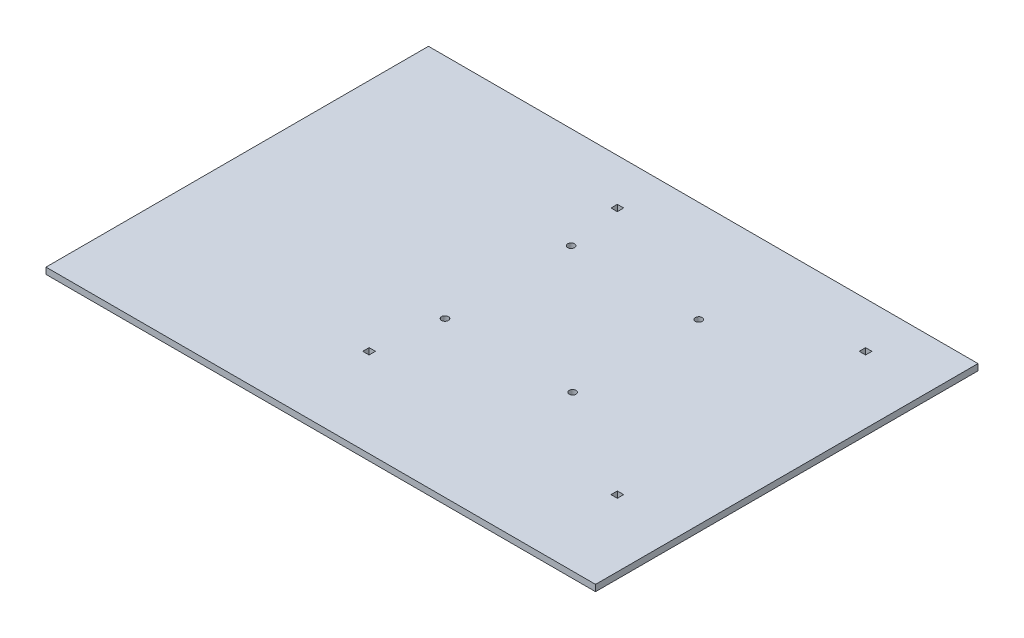
from build123d import *

# Parameters (mm, degrees)
SKETCH1_W           = 140
SKETCH1_H           = 160
BOSS_EXTRUDE1_DEPTH = 3
SKETCH2_W           = 120
SKETCH2_H           = 120
SKETCH2_W_2         = 114
SKETCH2_H_2         = 114
BOSS_EXTRUDE2_DEPTH = 70
SKETCH4_W           = 120
SKETCH4_H           = 120
BOSS_EXTRUDE4_DEPTH = 3
SKETCH5_R           = 2.1
SKETCH5_W           = 39.9
SKETCH5_H           = 19.71
CUT_EXTRUDE2_DEPTH  = 3
SKETCH6_W           = 18.298163042
SKETCH6_H           = 17.309993256
CUT_EXTRUDE3_DEPTH  = 3
CUT_EXTRUDE8_DEPTH  = 5
SKETCH15_W          = 259.021634325
SKETCH15_H          = 180.269434884
BOSS_EXTRUDE5_DEPTH = 3
SKETCH18_R          = 1.6
CUT_EXTRUDE9_DEPTH  = 10
SKETCH19_W          = 12
SKETCH19_H          = 4.5
SKETCH19_H_2        = 8.4
SKETCH19_W_2        = 10.084057066
SKETCH19_H_3        = 7.362028533
CUT_EXTRUDE11_DEPTH = 5
SKETCH20_W          = 147.415821731
SKETCH20_H          = 93.246752781
CUT_EXTRUDE13_DEPTH = 262.306082135
SKETCH21_W          = 3
SKETCH21_H          = 3
CUT_EXTRUDE14_DEPTH = 197.5483972


with BuildPart() as part:
    # Sketch1 → Boss-Extrude1 (new body)
    with BuildSketch(Plane(origin=(0, 0, 0), x_dir=(1, 0, 0), z_dir=(0, 1, 0))):
        Rectangle(SKETCH1_W, SKETCH1_H)
    extrude(amount=BOSS_EXTRUDE1_DEPTH)

    # Sketch2 → Boss-Extrude2 (add)
    with BuildSketch(Plane(origin=(0, 3, 0), x_dir=(1, 0, 0), z_dir=(0, 1, 0))):
        Rectangle(SKETCH2_W, SKETCH2_H)
        Rectangle(SKETCH2_W_2, SKETCH2_H_2, mode=Mode.SUBTRACT)
    extrude(amount=BOSS_EXTRUDE2_DEPTH)

    # Sketch4 → Boss-Extrude4 (add)
    with BuildSketch(Plane(origin=(0, 73, 0), x_dir=(1, 0, 0), z_dir=(0, 1, 0))):
        Rectangle(SKETCH4_W, SKETCH4_H)
    extrude(amount=BOSS_EXTRUDE4_DEPTH)

    # Sketch5 → Cut-Extrude2 (cut)
    with BuildSketch(Plane(origin=(0, 76, 0), x_dir=(1, 0, 0), z_dir=(0, 1, 0))):
        with Locations(Location((34.39, -4.925, 0), (0, 0, 270))):
            Circle(SKETCH5_R)
        with Locations(Location((34.39, 4.925, 0), (0, 0, 270))):
            Circle(SKETCH5_R)
        with Locations(Location((-15.03, -4.925, 0), (0, 0, 270))):
            Circle(SKETCH5_R)
        with Locations(Location((-15.03, 4.925, 0), (0, 0, 270))):
            Circle(SKETCH5_R)
        with Locations((9.68, 0)):
            Rectangle(SKETCH5_W, SKETCH5_H)
    extrude(amount=-CUT_EXTRUDE2_DEPTH, mode=Mode.SUBTRACT)

    # Sketch6 → Cut-Extrude3 (cut)
    with BuildSketch(Plane(origin=(0, 76, 0), x_dir=(1, 0, 0), z_dir=(0, 1, 0))):
        Rectangle(SKETCH6_W, SKETCH6_H)
    extrude(amount=-CUT_EXTRUDE3_DEPTH, mode=Mode.SUBTRACT)

    # Sketch13 → Cut-Extrude8 (cut)
    with BuildSketch(Plane(origin=(0, 76, 0), x_dir=(1, 0, 0), z_dir=(0, 1, 0))):
        with BuildLine():
            ThreePointArc((-3.792582359, 49.728765052), (-53.491503795, -1.722579942), (-0.349490011, -49.609426409))
            ThreePointArc((-0.349490011, -49.609426409), (5.82592347, -42.51288634), (-1.270616599, -36.337472859))
            ThreePointArc((-1.270616599, -36.337472859), (-40.195607742, -1.261740085), (-3.792582359, 36.42488497))
            ThreePointArc((-3.792582359, 36.42488497), (2.859357682, 43.076825011), (-3.792582359, 49.728765052))
        make_face()
    extrude(amount=-CUT_EXTRUDE8_DEPTH, mode=Mode.SUBTRACT)

    # Sketch15 → Boss-Extrude5 (add)
    with BuildSketch(Plane(origin=(0, 3, 0), x_dir=(1, 0, 0), z_dir=(0, 1, 0))):
        with Locations((-39.510817163, -10.134717442)):
            Rectangle(SKETCH15_W, SKETCH15_H)
    extrude(amount=-BOSS_EXTRUDE5_DEPTH)

    # Sketch18 → Cut-Extrude9 (cut)
    with BuildSketch(Plane(origin=(0, 3, 0), x_dir=(1, 0, 0), z_dir=(0, 1, 0))):
        with Locations(Location((-54, -27.231420358, 0), (0, 0, 270))):
            Circle(SKETCH18_R)
        with Locations(Location((6.2, -27.231420358, 0), (0, 0, 270))):
            Circle(SKETCH18_R)
        with Locations(Location((-54, 32.208579642, 0), (0, 0, 270))):
            Circle(SKETCH18_R)
        with Locations(Location((6.2, 32.208579642, 0), (0, 0, 270))):
            Circle(SKETCH18_R)
    extrude(amount=-CUT_EXTRUDE9_DEPTH, mode=Mode.SUBTRACT)

    # Sketch19 → Cut-Extrude11 (cut)
    with BuildSketch(Plane.ZY.offset(60)):
        with Locations((12.367420358, 33)):
            Rectangle(SKETCH19_W, SKETCH19_H)
        with Locations((-11.259414931, 37.2)):
            Rectangle(SKETCH19_W, SKETCH19_H_2)
        with Locations((-28.606781654, 36.742945388)):
            Rectangle(SKETCH19_W_2, SKETCH19_H_3)
    extrude(amount=-CUT_EXTRUDE11_DEPTH, mode=Mode.SUBTRACT)

    # Sketch20 → Cut-Extrude13 (cut, through all)
    with BuildSketch(Plane(origin=(60, 0, 0), x_dir=(0, 0, -1), z_dir=(1, 0, 0))):
        with Locations((-5.661677996, 49.623376391)):
            Rectangle(SKETCH20_W, SKETCH20_H)
    extrude(amount=-CUT_EXTRUDE13_DEPTH, mode=Mode.SUBTRACT)

    # Sketch21 → Cut-Extrude14 (cut, through all)
    with BuildSketch(Plane(origin=(0, 3, 0), x_dir=(1, 0, 0), z_dir=(0, 1, 0))):
        with Locations((-58.5, 58.5)):
            Rectangle(SKETCH21_W, SKETCH21_H)
        with Locations((58.5, -58.5)):
            Rectangle(SKETCH21_W, SKETCH21_H)
        with Locations((58.5, 58.5)):
            Rectangle(SKETCH21_W, SKETCH21_H)
        with Locations((-58.5, -58.5)):
            Rectangle(SKETCH21_W, SKETCH21_H)
    extrude(amount=-CUT_EXTRUDE14_DEPTH, mode=Mode.SUBTRACT)


solid = part.part
